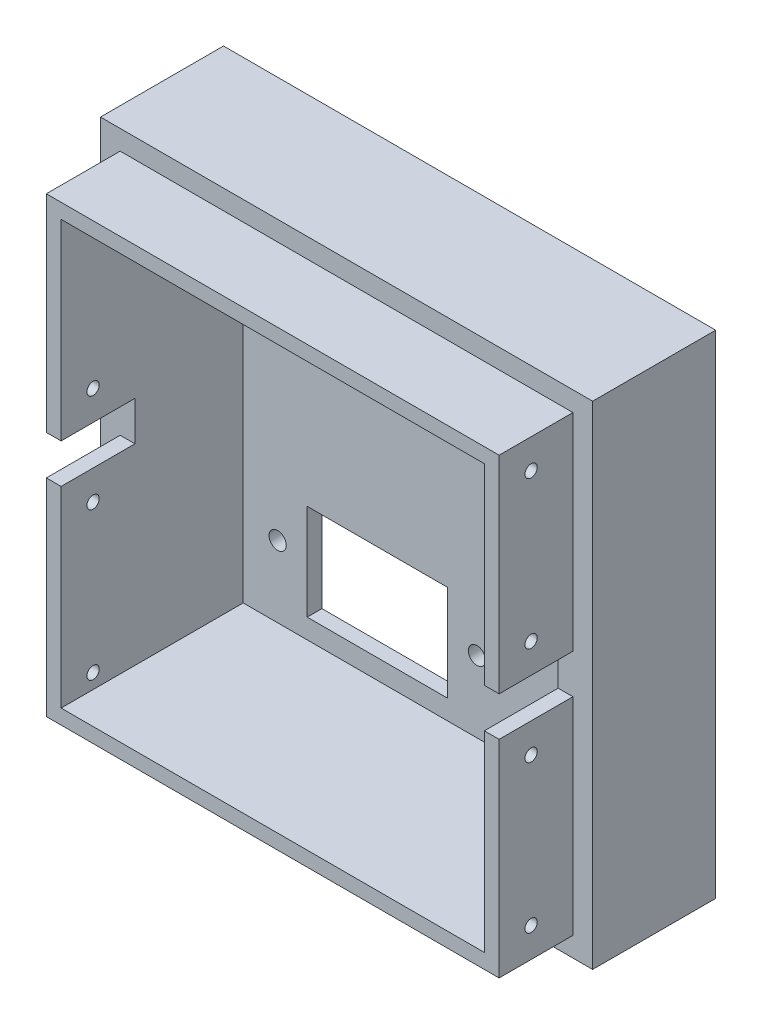
from build123d import *

# Parameters (mm, degrees)
SZKIC1_W                    = 100
SZKIC1_H                    = 100
DODANIE_WYCI_GNI_CIE1_DEPTH = 40
SZKIC3_W                    = 100
SZKIC3_H                    = 100
SZKIC3_W_2                  = 92
SZKIC3_H_2                  = 92
WYTNIJ_WYCI_GNI_CIE1_DEPTH  = 15
SZKIC4_W                    = 86
SZKIC4_H                    = 86
WYTNIJ_WYCI_GNI_CIE2_DEPTH  = 37
SZKIC6_W                    = 3
SZKIC6_H                    = 8
WYTNIJ_WYCI_GNI_CIE3_DEPTH  = 15
SZKIC9_R                    = 1.25
WYTNIJ_WYCI_GNI_CIE4_DEPTH  = 100
SZKIC10_R                   = 1.75
SZKIC10_W                   = 28.5
SZKIC10_H                   = 19.5
WYTNIJ_WYCI_GNI_CIE5_DEPTH  = 10
SZKIC11_W                   = 1.153846154
SZKIC11_H                   = 1
SZKIC11_H_2                 = 4.384615385
WYTNIJ_WYCI_GNI_CIE6_DEPTH  = 2
SZKIC12_R                   = 6.5
SZKIC12_R_2                 = 1.25
WYTNIJ_WYCI_GNI_CIE7_DEPTH  = 3
SZKIC13_R                   = 1
SZKIC13_W                   = 13
SZKIC13_H                   = 4
WYTNIJ_WYCI_GNI_CIE8_DEPTH  = 3


with BuildPart() as part:
    # Szkic1 → Dodanie-wyciągnięcie1 (new body)
    with BuildSketch(Plane.XY):
        with Locations((50, 50)):
            Rectangle(SZKIC1_W, SZKIC1_H)
    extrude(amount=DODANIE_WYCI_GNI_CIE1_DEPTH)

    # Szkic3 → Wytnij-wyciągnięcie1 (cut)
    with BuildSketch(Plane.XY.offset(40)):
        with Locations((50, 50)):
            Rectangle(SZKIC3_W, SZKIC3_H)
        with Locations((50, 50)):
            Rectangle(SZKIC3_W_2, SZKIC3_H_2, mode=Mode.SUBTRACT)
    extrude(amount=-WYTNIJ_WYCI_GNI_CIE1_DEPTH, mode=Mode.SUBTRACT)

    # Szkic4 → Wytnij-wyciągnięcie2 (cut)
    with BuildSketch(Plane.XY.offset(40)):
        with Locations((50, 50)):
            Rectangle(SZKIC4_W, SZKIC4_H)
    extrude(amount=-WYTNIJ_WYCI_GNI_CIE2_DEPTH, mode=Mode.SUBTRACT)

    # Szkic6 → Wytnij-wyciągnięcie3 (cut)
    with BuildSketch(Plane.XY.offset(40)):
        with Locations((5.5, 50)):
            Rectangle(SZKIC6_W, SZKIC6_H)
        with Locations((94.5, 50)):
            Rectangle(SZKIC6_W, SZKIC6_H)
    extrude(amount=-WYTNIJ_WYCI_GNI_CIE3_DEPTH, mode=Mode.SUBTRACT)

    # Szkic9 → Wytnij-wyciągnięcie4 (cut)
    with BuildSketch(Plane(origin=(96, 0, 0), x_dir=(0, 0, -1), z_dir=(1, 0, 0))):
        with Locations((-33.5, 60)):
            Circle(SZKIC9_R)
        with Locations((-33.5, 90)):
            Circle(SZKIC9_R)
        with Locations((-33.5, 40)):
            Circle(SZKIC9_R)
        with Locations((-33.5, 10)):
            Circle(SZKIC9_R)
    extrude(amount=-WYTNIJ_WYCI_GNI_CIE4_DEPTH, mode=Mode.SUBTRACT)

    # Szkic10 → Wytnij-wyciągnięcie5 (cut)
    with BuildSketch(Plane(origin=(0, 0, 0), x_dir=(-1, 0, 0), z_dir=(0, 0, -1))):
        with Locations((-54.5, 21.5)):
            Circle(SZKIC10_R)
        with Locations((-14, 21.5)):
            Circle(SZKIC10_R)
        with Locations((-34.25, 20.75)):
            Rectangle(SZKIC10_W, SZKIC10_H)
    extrude(amount=-WYTNIJ_WYCI_GNI_CIE5_DEPTH, mode=Mode.SUBTRACT)

    # Szkic11 → Wytnij-wyciągnięcie6 (cut)
    # profile 1 of 18: a face of its own
    with BuildSketch(Plane(origin=(0, 0, 0), x_dir=(-1, 0, 0), z_dir=(0, 0, -1))):
        with BuildLine():
            Line((-88.438026324, 50), (-88.438026324, 56))
            Line((-88.438026324, 56), (-87.28418017, 56))
            Line((-87.28418017, 56), (-87.28418017, 53.861778846))
            add(Edge.make_bspline(
                [(-87.28418017, 53.861778846), (-87.2409879, 53.90952015), (-87.156831408, 54.002540049), (-87.018245306, 54.124928355), (-86.874039765, 54.229121733), (-86.722831279, 54.313298956), (-86.566560567, 54.380903641), (-86.40372875, 54.427336018), (-86.234710156, 54.455976767), (-86.120031568, 54.45966595), (-86.061824401, 54.461538462)],
                knots=[0, 0, 0, 0, 1.09742733, 2.138244462, 3.14714167, 4.12618092, 5.084514129, 6.044794579, 7.007600552, 8, 8, 8, 8], degree=3))
            add(Edge.make_bspline(
                [(-86.061824401, 54.461538462), (-85.998803526, 54.460240324), (-85.875324724, 54.457696841), (-85.694662272, 54.42826264), (-85.52199364, 54.38450399), (-85.357069749, 54.321828525), (-85.201730271, 54.239060407), (-85.053867125, 54.140101748), (-84.915212722, 54.022433318), (-84.785340675, 53.888045244), (-84.667558215, 53.736249782), (-84.563487831, 53.568703554), (-84.477143379, 53.384449477), (-84.406226002, 53.185154165), (-84.351141212, 52.969894495), (-84.311815909, 52.739194657), (-84.289319503, 52.492834176), (-84.285926063, 52.323763914), (-84.28418017, 52.236778846)],
                knots=[0, 0, 0, 0, 0.942730505, 1.847121823, 2.733183872, 3.606606819, 4.481367714, 5.363155244, 6.265634696, 7.198966623, 8.156505419, 9.137011998, 10.145934455, 11.197093156, 12.299939524, 13.468576766, 14.697606431, 16, 16, 16, 16], degree=3))
            add(Edge.make_bspline(
                [(-84.28418017, 52.236778846), (-84.285938987, 52.146594052), (-84.289353055, 51.971534837), (-84.311585404, 51.716726356), (-84.351769525, 51.478329728), (-84.404522671, 51.255043238), (-84.475880448, 51.048305461), (-84.562704156, 50.857715492), (-84.663497668, 50.681540372), (-84.781370286, 50.523709881), (-84.91014754, 50.383593221), (-85.044749845, 50.25962985), (-85.187348199, 50.155312605), (-85.337366147, 50.071045712), (-85.493407278, 50.003760023), (-85.656585563, 49.957108224), (-85.826453283, 49.928667339), (-85.941921846, 49.924959026), (-86.000526324, 49.923076923)],
                knots=[0, 0, 0, 0, 1.342990017, 2.606900428, 3.804454117, 4.940338677, 6.01953414, 7.05541413, 8.055152764, 9.03596787, 9.981868581, 10.885627531, 11.756739119, 12.606254667, 13.442893865, 14.281233033, 15.127663507, 16, 16, 16, 16], degree=3))
            add(Edge.make_bspline(
                [(-86.000526324, 49.923076923), (-86.059157326, 49.92520152), (-86.176906424, 49.929468365), (-86.352728941, 49.963075267), (-86.526312714, 50.019599556), (-86.69821826, 50.094401621), (-86.863731589, 50.192757689), (-87.016761095, 50.317479719), (-87.160656485, 50.463218902), (-87.242330353, 50.575751554), (-87.28418017, 50.633413462)],
                knots=[0, 0, 0, 0, 0.921157575, 1.849967926, 2.801929881, 3.785969375, 4.79143669, 5.817208272, 6.881534093, 8, 8, 8, 8], degree=3))
            Line((-87.28418017, 50.633413462), (-87.28418017, 50))
            Line((-87.28418017, 50), (-88.438026324, 50))
        make_face()
        with BuildLine():
            add(Edge.make_bspline(
                [(-87.28418017, 52.275240385), (-87.283463921, 52.218732515), (-87.282081131, 52.109638521), (-87.272222401, 51.952066823), (-87.257535984, 51.805838811), (-87.233712448, 51.671359411), (-87.20806031, 51.546831993), (-87.170463699, 51.435152249), (-87.131523286, 51.332889695), (-87.096644036, 51.27206792), (-87.079853247, 51.242788462)],
                knots=[0, 0, 0, 0, 1.27404814, 2.459675089, 3.559050391, 4.585286877, 5.538680085, 6.421449734, 7.240089651, 8, 8, 8, 8], degree=3))
            add(Edge.make_bspline(
                [(-87.079853247, 51.242788462), (-87.055814981, 51.205352784), (-87.009166568, 51.13270549), (-86.927839549, 51.036152586), (-86.841498398, 50.953170968), (-86.747365928, 50.886829271), (-86.649224005, 50.832578715), (-86.543239023, 50.797042996), (-86.432718026, 50.772838865), (-86.356429067, 50.770442902), (-86.317834017, 50.769230769)],
                knots=[0, 0, 0, 0, 1.13317841, 2.199034441, 3.210601728, 4.17712673, 5.127651621, 6.057985678, 7.017523073, 8, 8, 8, 8], degree=3))
            add(Edge.make_bspline(
                [(-86.317834017, 50.769230769), (-86.287711505, 50.770008913), (-86.228640097, 50.771534884), (-86.141803738, 50.787999355), (-86.058225652, 50.81456616), (-85.977961073, 50.851872256), (-85.901164265, 50.899313428), (-85.82863209, 50.957952478), (-85.759316447, 51.026630034), (-85.692264047, 51.10482658), (-85.63238885, 51.195677182), (-85.578882427, 51.297978995), (-85.536710892, 51.414057406), (-85.498786183, 51.540553276), (-85.472268283, 51.680015093), (-85.451543003, 51.83080144), (-85.439729248, 51.993801662), (-85.438605498, 52.10655238), (-85.438026324, 52.164663462)],
                knots=[0, 0, 0, 0, 0.78356255, 1.536596371, 2.292155343, 3.062338243, 3.835342336, 4.636962799, 5.485351512, 6.373661662, 7.314050153, 8.312593822, 9.372473365, 10.524658142, 11.748175488, 13.064264604, 14.486938588, 16, 16, 16, 16], degree=3))
            add(Edge.make_bspline(
                [(-85.438026324, 52.164663462), (-85.438568556, 52.226783839), (-85.439612169, 52.346344478), (-85.451722407, 52.518896802), (-85.471818599, 52.678296261), (-85.500230485, 52.824102235), (-85.536203796, 52.956918729), (-85.580375246, 53.076240737), (-85.632710337, 53.1828029), (-85.694776737, 53.274971936), (-85.763028387, 53.354225156), (-85.833225999, 53.425133999), (-85.910320496, 53.483033391), (-85.990946017, 53.531752991), (-86.077029787, 53.569389212), (-86.16803908, 53.595326353), (-86.263037662, 53.613363011), (-86.328165089, 53.614705601), (-86.361103247, 53.615384615)],
                knots=[0, 0, 0, 0, 1.541669275, 2.967189997, 4.290690924, 5.527159073, 6.651403144, 7.702408128, 8.680806828, 9.590976681, 10.451726763, 11.274471125, 12.062089487, 12.838070645, 13.608488225, 14.385742736, 15.183590336, 16, 16, 16, 16], degree=3))
            add(Edge.make_bspline(
                [(-86.361103247, 53.615384615), (-86.393620258, 53.614591887), (-86.457447798, 53.613035844), (-86.55111235, 53.596824684), (-86.640123396, 53.570273453), (-86.725499548, 53.534019308), (-86.806068632, 53.486413817), (-86.883652654, 53.429981422), (-86.956004055, 53.361937475), (-87.023089039, 53.283663608), (-87.085207904, 53.195226372), (-87.13902924, 53.095701107), (-87.183414276, 52.984528071), (-87.220385831, 52.863525835), (-87.249252682, 52.731677242), (-87.268895594, 52.589000872), (-87.282942705, 52.435775288), (-87.283759895, 52.329762204), (-87.28418017, 52.275240385)],
                knots=[0, 0, 0, 0, 0.853654749, 1.675636261, 2.488263676, 3.289909134, 4.105938102, 4.941754496, 5.805666242, 6.708768126, 7.646124924, 8.639937881, 9.673965161, 10.786053658, 11.960883777, 13.21578984, 14.568099356, 16, 16, 16, 16], degree=3))
        make_face(mode=Mode.SUBTRACT)
    # profile 2 of 18: a face of its own
    with BuildSketch(Plane(origin=(0, 0, 0), x_dir=(-1, 0, 0), z_dir=(0, 0, -1))):
        with BuildLine():
            Line((-83.899564786, 54.384615385), (-82.745718632, 54.384615385))
            Line((-82.745718632, 54.384615385), (-81.78418017, 51.280048077))
            Line((-81.78418017, 51.280048077), (-80.822641709, 54.384615385))
            Line((-80.822641709, 54.384615385), (-79.668795555, 54.384615385))
            Line((-79.668795555, 54.384615385), (-81.126728247, 50.203125))
            Line((-81.126728247, 50.203125), (-81.403170555, 49.411057692))
            add(Edge.make_bspline(
                [(-81.403170555, 49.411057692), (-81.425903437, 49.354349662), (-81.468651851, 49.247712135), (-81.536784362, 49.099927646), (-81.601124989, 48.972451412), (-81.668144958, 48.865771071), (-81.733624363, 48.772478119), (-81.805390592, 48.692404446), (-81.880020044, 48.619009879), (-81.961102199, 48.555125652), (-82.04952495, 48.498464458), (-82.14700339, 48.450060934), (-82.253493204, 48.405890413), (-82.369651795, 48.37106823), (-82.493821137, 48.341061887), (-82.6263992, 48.323736786), (-82.766218678, 48.308769721), (-82.862258113, 48.308057899), (-82.911584017, 48.307692308)],
                knots=[0, 0, 0, 0, 1.442389574, 2.712364636, 3.842141792, 4.810870158, 5.685193676, 6.529785669, 7.346031511, 8.154233153, 8.962545531, 9.821428725, 10.720930479, 11.681493955, 12.682037037, 13.733651981, 14.836002494, 16, 16, 16, 16], degree=3))
            add(Edge.make_bspline(
                [(-82.911584017, 48.307692308), (-83.013234613, 48.310172035), (-83.216077822, 48.315120317), (-83.415475609, 48.352664515), (-83.514949401, 48.371394231)],
                knots=[0, 0, 0, 0, 1.002257816, 2, 2, 2, 2], degree=3))
            Line((-83.514949401, 48.371394231), (-83.591872478, 49.207932692))
            add(Edge.make_bspline(
                [(-83.591872478, 49.207932692), (-83.552286959, 49.199507974), (-83.475840713, 49.183238436), (-83.363099995, 49.166234895), (-83.256311712, 49.156415785), (-83.186842508, 49.154685048), (-83.153170555, 49.153846154)],
                knots=[0, 0, 0, 0, 1.096454798, 2.117437249, 3.087515614, 4, 4, 4, 4], degree=3))
            add(Edge.make_bspline(
                [(-83.153170555, 49.153846154), (-83.123890657, 49.154496079), (-83.067518926, 49.155747362), (-82.985636253, 49.166551516), (-82.909844348, 49.185705069), (-82.839970881, 49.212487424), (-82.774994455, 49.24458156), (-82.71672463, 49.286454874), (-82.664037631, 49.335215997), (-82.602075631, 49.412005257), (-82.53373991, 49.520605381), (-82.463359822, 49.665734529), (-82.401382173, 49.826494133), (-82.37009991, 49.940783525), (-82.353891709, 50)],
                knots=[0, 0, 0, 0, 0.826282398, 1.5908173, 2.325927711, 3.027474672, 3.700169566, 4.365407898, 5.04557163, 5.720354759, 7.144619778, 8.656909909, 10.267853154, 12, 12, 12, 12], degree=3))
            Line((-82.353891709, 50), (-83.899564786, 54.384615385))
        make_face()
    # profile 3 of 18: a face of its own
    with BuildSketch(Plane(origin=(0, 0, 0), x_dir=(-1, 0, 0), z_dir=(0, 0, -1))):
        with BuildLine():
            Line((-74.438026324, 56), (-73.28418017, 56))
            Line((-73.28418017, 56), (-73.28418017, 52.217548077))
            add(Edge.make_bspline(
                [(-73.28418017, 52.217548077), (-73.284695796, 52.157446276), (-73.28569637, 52.040818296), (-73.291844426, 51.87130117), (-73.300991696, 51.712528368), (-73.315063345, 51.564522679), (-73.334891098, 51.427604055), (-73.355904378, 51.300680335), (-73.381417038, 51.184393011), (-73.404279125, 51.111642431), (-73.415189786, 51.076923077)],
                knots=[0, 0, 0, 0, 1.251619961, 2.428777588, 3.532126049, 4.56323557, 5.523704531, 6.412540087, 7.242403515, 8, 8, 8, 8], degree=3))
            add(Edge.make_bspline(
                [(-73.415189786, 51.076923077), (-73.430437557, 51.034139374), (-73.460613775, 50.949467955), (-73.519266699, 50.828687794), (-73.586714532, 50.714341946), (-73.662767453, 50.60593488), (-73.746707103, 50.503031954), (-73.841380564, 50.408345447), (-73.943457479, 50.31857262), (-74.055809156, 50.237433406), (-74.175607991, 50.161780163), (-74.306266603, 50.098748917), (-74.44521423, 50.044226053), (-74.593617022, 49.999940414), (-74.751518012, 49.965289582), (-74.918512677, 49.940068314), (-75.09482348, 49.925737068), (-75.215243932, 49.923978383), (-75.276968632, 49.923076923)],
                knots=[0, 0, 0, 0, 0.925533072, 1.831683394, 2.73255258, 3.630007683, 4.529542467, 5.436465751, 6.357118906, 7.298274949, 8.259461937, 9.242242071, 10.251058183, 11.300341426, 12.396409345, 13.544807631, 14.74152597, 16, 16, 16, 16], degree=3))
            add(Edge.make_bspline(
                [(-75.276968632, 49.923076923), (-75.349140887, 49.92482129), (-75.489450262, 49.928212496), (-75.693486966, 49.950727007), (-75.884828332, 49.990105836), (-76.062898606, 50.046984986), (-76.229517368, 50.117691228), (-76.382669337, 50.205887561), (-76.523168463, 50.309804524), (-76.650101111, 50.429760619), (-76.763530029, 50.564542795), (-76.861439466, 50.715333595), (-76.944538499, 50.880556087), (-77.01150214, 51.060957731), (-77.064370083, 51.255674843), (-77.102502986, 51.465117405), (-77.125257337, 51.689404674), (-77.128609421, 51.843696273), (-77.130334017, 51.923076923)],
                knots=[0, 0, 0, 0, 1.114068574, 2.165849827, 3.164101702, 4.124467949, 5.046988974, 5.952942428, 6.846011651, 7.738523925, 8.642829306, 9.558838605, 10.50752403, 11.491963144, 12.524197802, 13.618364352, 14.774685164, 16, 16, 16, 16], degree=3))
            Line((-77.130334017, 51.923076923), (-75.976487863, 52))
            add(Edge.make_bspline(
                [(-75.976487863, 52), (-75.974415528, 51.95750937), (-75.970441708, 51.876031203), (-75.959407776, 51.758576772), (-75.945455148, 51.650622388), (-75.927198423, 51.552492068), (-75.907537944, 51.463356639), (-75.881998675, 51.384970258), (-75.855149345, 51.314576625), (-75.831566597, 51.273390739), (-75.820237863, 51.253605769)],
                knots=[0, 0, 0, 0, 1.326609226, 2.543847584, 3.678365909, 4.719972403, 5.656527627, 6.521948534, 7.28997025, 8, 8, 8, 8], degree=3))
            add(Edge.make_bspline(
                [(-75.820237863, 51.253605769), (-75.802894723, 51.227437655), (-75.768761264, 51.175935546), (-75.706492784, 51.10882288), (-75.639641373, 51.050149237), (-75.564549847, 51.004019986), (-75.483308387, 50.967740717), (-75.395307123, 50.941378847), (-75.300788682, 50.925394252), (-75.235766484, 50.923862028), (-75.202449401, 50.923076923)],
                knots=[0, 0, 0, 0, 1.023658308, 2.014687051, 2.979722519, 3.920049697, 4.880550909, 5.878122304, 6.912759386, 8, 8, 8, 8], degree=3))
            add(Edge.make_bspline(
                [(-75.202449401, 50.923076923), (-75.168763307, 50.923704652), (-75.104007887, 50.924911348), (-75.010687813, 50.935884301), (-74.924884628, 50.953664709), (-74.846551598, 50.978657757), (-74.775423377, 51.011102407), (-74.713076589, 51.052609721), (-74.656824644, 51.099314845), (-74.608231843, 51.155497869), (-74.566829825, 51.223193909), (-74.532261021, 51.305588915), (-74.502522418, 51.403021805), (-74.479538912, 51.516233297), (-74.459975415, 51.644139571), (-74.44770364, 51.787871546), (-74.438882599, 51.947004415), (-74.438319727, 52.058479098), (-74.438026324, 52.116586538)],
                knots=[0, 0, 0, 0, 0.980314827, 1.884477813, 2.730827652, 3.527503874, 4.27366112, 4.998269146, 5.70163477, 6.396145331, 7.150281155, 8.001758491, 8.990432449, 10.111292654, 11.361572691, 12.75538406, 14.308707205, 16, 16, 16, 16], degree=3))
            Line((-74.438026324, 52.116586538), (-74.438026324, 56))
        make_face()
    # profile 4 of 18: a face of its own
    with BuildSketch(Plane(origin=(0, 0, 0), x_dir=(-1, 0, 0), z_dir=(0, 0, -1))):
        with BuildLine():
            Line((-71.28418017, 53.076923077), (-72.28418017, 53.230769231))
            add(Edge.make_bspline(
                [(-72.28418017, 53.230769231), (-72.269193729, 53.281454323), (-72.239858076, 53.380669359), (-72.186026678, 53.522845402), (-72.122990658, 53.654287032), (-72.053470867, 53.776564533), (-71.975325166, 53.888341174), (-71.88980256, 53.989907729), (-71.796419711, 54.080916588), (-71.694730321, 54.162072318), (-71.582777994, 54.234166119), (-71.458021391, 54.295287315), (-71.320647487, 54.34675223), (-71.170849163, 54.38811199), (-71.008877739, 54.42269035), (-70.83349346, 54.443858699), (-70.645827526, 54.45913896), (-70.516586871, 54.460722932), (-70.450045555, 54.461538462)],
                knots=[0, 0, 0, 0, 1.047140172, 2.049755565, 3.008539736, 3.933190086, 4.833981818, 5.707167246, 6.560530269, 7.413560864, 8.281243119, 9.193714071, 10.161006392, 11.183910126, 12.270717139, 13.439589873, 14.681737877, 16, 16, 16, 16], degree=3))
            add(Edge.make_bspline(
                [(-70.450045555, 54.461538462), (-70.389537866, 54.461202519), (-70.272464995, 54.460552523), (-70.102860985, 54.452030803), (-69.945202932, 54.438057545), (-69.799697112, 54.417402598), (-69.665863964, 54.392840427), (-69.544130909, 54.361692912), (-69.434135531, 54.324935372), (-69.307043025, 54.267796502), (-69.167439373, 54.187501868), (-69.0217328, 54.078475711), (-68.904832279, 53.954453054), (-68.827466393, 53.838700642), (-68.7817772, 53.733784032), (-68.749537344, 53.641346323), (-68.72637279, 53.533342307), (-68.703573397, 53.411318352), (-68.689582125, 53.274614219), (-68.676955392, 53.123196354), (-68.670116911, 52.957192479), (-68.669246923, 52.841350993), (-68.668795555, 52.78125)],
                knots=[0, 0, 0, 0, 1.253259065, 2.424859341, 3.516580225, 4.530621704, 5.468151732, 6.333678254, 7.13150538, 7.867126506, 9.216626747, 10.459871386, 11.622324159, 12.731817101, 13.322505456, 13.989117254, 14.756090433, 15.607496751, 16.559714447, 17.600403876, 18.755039204, 20, 20, 20, 20], degree=3))
            Line((-68.668795555, 52.78125), (-68.668795555, 51.433894231))
            add(Edge.make_bspline(
                [(-68.668795555, 51.433894231), (-68.668421798, 51.387421334), (-68.667700014, 51.297674757), (-68.66622042, 51.167793114), (-68.659520723, 51.047629266), (-68.6524818, 50.937035148), (-68.644372344, 50.835579266), (-68.63384868, 50.743729956), (-68.62067995, 50.661089558), (-68.599552528, 50.562391997), (-68.565567888, 50.442645159), (-68.510002506, 50.299109879), (-68.443347315, 50.149604989), (-68.389089641, 50.050908281), (-68.361103247, 50)],
                knots=[0, 0, 0, 0, 1.124218554, 2.171045354, 3.141373911, 4.034856482, 4.851737235, 5.603038048, 6.270604849, 6.87504238, 8.043824301, 9.276776929, 10.59534724, 12, 12, 12, 12], degree=3))
            Line((-68.361103247, 50), (-69.514949401, 50))
            add(Edge.make_bspline(
                [(-69.514949401, 50), (-69.52318507, 50.023165167), (-69.541231108, 50.073924795), (-69.565602347, 50.159011482), (-69.594809685, 50.258147789), (-69.614066321, 50.32968195), (-69.624324401, 50.367788462)],
                knots=[0, 0, 0, 0, 0.768508203, 1.683958961, 2.766236402, 4, 4, 4, 4], degree=3))
            add(Edge.make_bspline(
                [(-69.624324401, 50.367788462), (-69.628746882, 50.384611338), (-69.636751936, 50.41506213), (-69.647419435, 50.456478366), (-69.656667552, 50.488142365), (-69.662743803, 50.506023242), (-69.665189786, 50.513221154)],
                knots=[0, 0, 0, 0, 1.381357368, 2.500370598, 3.396327181, 4, 4, 4, 4], degree=3))
            add(Edge.make_bspline(
                [(-69.665189786, 50.513221154), (-69.714002495, 50.466160381), (-69.809520764, 50.374070357), (-69.965303278, 50.254804507), (-70.124458334, 50.152131613), (-70.289571431, 50.068338782), (-70.459400909, 50.002850664), (-70.635628082, 49.957183735), (-70.817310889, 49.928768438), (-70.940727815, 49.924984191), (-71.00293017, 49.923076923)],
                knots=[0, 0, 0, 0, 1.082260538, 2.117802027, 3.127898709, 4.103827344, 5.070056335, 6.029309159, 7.006768236, 8, 8, 8, 8], degree=3))
            add(Edge.make_bspline(
                [(-71.00293017, 49.923076923), (-71.057050405, 49.924329626), (-71.162755289, 49.926776342), (-71.317001507, 49.942938831), (-71.461990886, 49.973592652), (-71.598387506, 50.014360927), (-71.726522126, 50.065614595), (-71.845287644, 50.13001036), (-71.955380799, 50.206104417), (-72.055708835, 50.293618163), (-72.145628995, 50.389668956), (-72.224544063, 50.491866514), (-72.28982661, 50.601581346), (-72.343834562, 50.716698465), (-72.386565741, 50.838225691), (-72.416041376, 50.96561017), (-72.434830102, 51.099201521), (-72.436945118, 51.190239709), (-72.438026324, 51.236778846)],
                knots=[0, 0, 0, 0, 1.186431605, 2.317277787, 3.39378889, 4.430144672, 5.434756152, 6.413230964, 7.385260177, 8.362630794, 9.325691837, 10.265445477, 11.187216893, 12.118354241, 13.048828682, 14.005299944, 14.980300216, 16, 16, 16, 16], degree=3))
            add(Edge.make_bspline(
                [(-72.438026324, 51.236778846), (-72.436062586, 51.297834012), (-72.432209353, 51.417635992), (-72.398544919, 51.591684686), (-72.345828058, 51.756090082), (-72.270901119, 51.908789877), (-72.177669497, 52.048417015), (-72.065510889, 52.171662406), (-71.936041743, 52.276601468), (-71.786434816, 52.365718653), (-71.610970343, 52.440789132), (-71.406051378, 52.513108171), (-71.166688651, 52.577923045), (-70.995103708, 52.615006355), (-70.904372478, 52.634615385)],
                knots=[0, 0, 0, 0, 0.9565892, 1.877012003, 2.769038917, 3.656897043, 4.535078379, 5.39337207, 6.259743944, 7.138913465, 8.11486349, 9.247429708, 10.544487161, 12, 12, 12, 12], degree=3))
            add(Edge.make_bspline(
                [(-70.904372478, 52.634615385), (-70.841852239, 52.647337324), (-70.721502976, 52.67182661), (-70.548627014, 52.708647181), (-70.39069125, 52.745759478), (-70.248365917, 52.783461035), (-70.120145927, 52.81771537), (-70.007369493, 52.852232864), (-69.909591597, 52.886972979), (-69.850197809, 52.911634885), (-69.822641709, 52.923076923)],
                knots=[0, 0, 0, 0, 1.365613701, 2.628758346, 3.783158308, 4.837685682, 5.780080249, 6.623655076, 7.36143661, 8, 8, 8, 8], degree=3))
            Line((-69.822641709, 52.923076923), (-69.822641709, 53.032451923))
            add(Edge.make_bspline(
                [(-69.822641709, 53.032451923), (-69.824179247, 53.081486252), (-69.827034541, 53.172545788), (-69.855420909, 53.298812886), (-69.904696594, 53.402813866), (-69.964175356, 53.472129873), (-70.023023725, 53.513944517), (-70.074986327, 53.541773589), (-70.135876952, 53.563983198), (-70.20484029, 53.583668063), (-70.283061581, 53.597119499), (-70.369637858, 53.60828901), (-70.464801208, 53.613769649), (-70.530970485, 53.614831581), (-70.56543017, 53.615384615)],
                knots=[0, 0, 0, 0, 1.600506204, 2.972230995, 4.195852174, 5.327580964, 5.908906329, 6.547275261, 7.247479517, 8.022494018, 8.887774365, 9.837646189, 10.873887764, 12, 12, 12, 12], degree=3))
            add(Edge.make_bspline(
                [(-70.56543017, 53.615384615), (-70.611220403, 53.614290459), (-70.69823371, 53.612211278), (-70.820856159, 53.588947913), (-70.92875354, 53.55248153), (-71.022277809, 53.498038034), (-71.102902805, 53.42407715), (-71.173107644, 53.328702436), (-71.235301399, 53.211498615), (-71.26727431, 53.123469159), (-71.28418017, 53.076923077)],
                knots=[0, 0, 0, 0, 1.120680009, 2.129582446, 3.045508635, 3.899130849, 4.760899303, 5.707254252, 6.787697471, 8, 8, 8, 8], degree=3))
        make_face()
        with BuildLine():
            add(Edge.make_bspline(
                [(-69.822641709, 52.076923077), (-69.862243056, 52.064693816), (-69.951435839, 52.037150261), (-70.10125381, 51.996682767), (-70.281837701, 51.954039218), (-70.448366237, 51.917140375), (-70.587381884, 51.887171292), (-70.685447904, 51.862667907), (-70.773817366, 51.839303218), (-70.852622412, 51.814766652), (-70.921968513, 51.791669677), (-70.980846098, 51.766920718), (-71.031304504, 51.745249404), (-71.059605956, 51.727106629), (-71.072641709, 51.71875)],
                knots=[0, 0, 0, 0, 1.144223484, 2.577096135, 4.283377528, 6.266557578, 7.286341447, 8.209198618, 9.057088726, 9.80932547, 10.487940513, 11.073343897, 11.57317876, 12, 12, 12, 12], degree=3))
            add(Edge.make_bspline(
                [(-71.072641709, 51.71875), (-71.104913236, 51.693332788), (-71.166846281, 51.644554021), (-71.234360476, 51.550290098), (-71.277202477, 51.445784564), (-71.281825791, 51.371806992), (-71.28418017, 51.334134615)],
                knots=[0, 0, 0, 0, 1.075028234, 2.063111864, 3.013658082, 4, 4, 4, 4], degree=3))
            add(Edge.make_bspline(
                [(-71.28418017, 51.334134615), (-71.2821036, 51.296651405), (-71.278030249, 51.223125253), (-71.245585883, 51.117176964), (-71.191027434, 51.020112024), (-71.116719549, 50.933822099), (-71.027304678, 50.859117489), (-70.921905103, 50.807914419), (-70.805786902, 50.774851971), (-70.724324669, 50.771152246), (-70.682016709, 50.769230769)],
                knots=[0, 0, 0, 0, 0.976809721, 1.916086158, 2.861451878, 3.862738809, 4.873423621, 5.878632484, 6.898253484, 8, 8, 8, 8], degree=3))
            add(Edge.make_bspline(
                [(-70.682016709, 50.769230769), (-70.633672579, 50.771418262), (-70.536346713, 50.775822097), (-70.393605511, 50.816059902), (-70.252675587, 50.875450326), (-70.167103844, 50.933900587), (-70.123122478, 50.963942308)],
                knots=[0, 0, 0, 0, 0.962503947, 1.937702252, 2.940039444, 4, 4, 4, 4], degree=3))
            add(Edge.make_bspline(
                [(-70.123122478, 50.963942308), (-70.092061214, 50.988948602), (-70.031667578, 51.037569322), (-69.959686849, 51.126419026), (-69.900286791, 51.220933923), (-69.876613427, 51.290659089), (-69.864709017, 51.325721154)],
                knots=[0, 0, 0, 0, 1.055399509, 2.052054707, 3.020454315, 4, 4, 4, 4], degree=3))
            add(Edge.make_bspline(
                [(-69.864709017, 51.325721154), (-69.85814805, 51.354474418), (-69.842789686, 51.421782038), (-69.83195399, 51.540274087), (-69.823188591, 51.689359924), (-69.822835096, 51.799254585), (-69.822641709, 51.859375)],
                knots=[0, 0, 0, 0, 0.659054705, 1.542760655, 2.655710416, 4, 4, 4, 4], degree=3))
            Line((-69.822641709, 51.859375), (-69.822641709, 52.076923077))
        make_face(mode=Mode.SUBTRACT)
    # profile 5 of 18: a face of its own
    with BuildSketch(Plane(origin=(0, 0, 0), x_dir=(-1, 0, 0), z_dir=(0, 0, -1))):
        Polygon((-67.438026324, 50), (-67.438026324, 56), (-66.28418017, 56), (-66.28418017, 52.840144231), (-64.938026324, 54.384615385), (-63.630334017, 54.384615385), (-65.078651324, 52.758413462), (-63.55341094, 50), (-64.707257094, 50), (-65.808218632, 51.938701923), (-66.28418017, 51.403846154), (-66.28418017, 50), align=None)
    # profile 6 of 18: a face of its own
    with BuildSketch(Plane(origin=(0, 0, 0), x_dir=(-1, 0, 0), z_dir=(0, 0, -1))):
        with BuildLine():
            Line((-60.130334017, 50), (-60.130334017, 50.645432692))
            add(Edge.make_bspline(
                [(-60.130334017, 50.645432692), (-60.168536487, 50.590190016), (-60.244344493, 50.48056786), (-60.383657598, 50.336917585), (-60.539664823, 50.212271372), (-60.71127887, 50.108388796), (-60.893230245, 50.025533876), (-61.082472009, 49.966044309), (-61.276818716, 49.930307915), (-61.408233578, 49.925490749), (-61.474084017, 49.923076923)],
                knots=[0, 0, 0, 0, 1.012300957, 2.008784164, 3.006972158, 4.019128624, 5.028517728, 6.017265291, 7.006475003, 8, 8, 8, 8], degree=3))
            add(Edge.make_bspline(
                [(-61.474084017, 49.923076923), (-61.540758472, 49.925284029), (-61.671517242, 49.929612499), (-61.862040167, 49.966719549), (-62.041885549, 50.027368915), (-62.210158624, 50.110765635), (-62.361234701, 50.217507425), (-62.492757439, 50.343892165), (-62.599044219, 50.491885185), (-62.669641, 50.629492287), (-62.713942648, 50.750476127), (-62.742265979, 50.850698609), (-62.767942827, 50.959247417), (-62.787644463, 51.076129808), (-62.803627744, 51.201214447), (-62.813670159, 51.334415225), (-62.82146876, 51.47627154), (-62.822243438, 51.573705853), (-62.822641709, 51.623798077)],
                knots=[0, 0, 0, 0, 1.289498181, 2.528902495, 3.740215999, 4.953909685, 6.150063847, 7.307074614, 8.467199117, 9.660131987, 10.288158488, 10.958106275, 11.674712228, 12.445953132, 13.25095176, 14.114470792, 15.030625377, 16, 16, 16, 16], degree=3))
            Line((-62.822641709, 51.623798077), (-62.822641709, 54.384615385))
            Line((-62.822641709, 54.384615385), (-61.668795555, 54.384615385))
            Line((-61.668795555, 54.384615385), (-61.668795555, 52.361778846))
            add(Edge.make_bspline(
                [(-61.668795555, 52.361778846), (-61.668457236, 52.288061119), (-61.667815515, 52.148233942), (-61.665947317, 51.949488382), (-61.660821011, 51.773610981), (-61.65534481, 51.620104811), (-61.647224825, 51.489022298), (-61.636696137, 51.380368553), (-61.624943091, 51.294132428), (-61.608873986, 51.210063007), (-61.575881094, 51.1256862), (-61.530436112, 51.035049768), (-61.468311175, 50.957248383), (-61.396444511, 50.889675977), (-61.312698269, 50.833683035), (-61.216096708, 50.798326679), (-61.110900313, 50.771935691), (-61.036772184, 50.770157764), (-60.998122478, 50.769230769)],
                knots=[0, 0, 0, 0, 1.799930418, 3.414093185, 4.852592097, 6.095879458, 7.164323302, 8.058836106, 8.760219181, 9.289718358, 10.143846288, 10.96209893, 11.756558504, 12.559405005, 13.365225682, 14.195378484, 15.059087384, 16, 16, 16, 16], degree=3))
            add(Edge.make_bspline(
                [(-60.998122478, 50.769230769), (-60.953496048, 50.771454805), (-60.865617315, 50.775834395), (-60.737181724, 50.806355134), (-60.617234376, 50.859360042), (-60.505387737, 50.929867152), (-60.407465953, 51.017162275), (-60.322434698, 51.114121568), (-60.256198336, 51.221870329), (-60.213963288, 51.322292091), (-60.188653894, 51.41740311), (-60.174767264, 51.511803301), (-60.159531039, 51.627067355), (-60.150214648, 51.764770968), (-60.139738394, 51.924150878), (-60.134680089, 52.105744967), (-60.13087349, 52.309277037), (-60.130520102, 52.452320915), (-60.130334017, 52.527644231)],
                knots=[0, 0, 0, 0, 0.960139447, 1.890714513, 2.821289579, 3.770841791, 4.723832156, 5.63466777, 6.536687779, 7.433335375, 7.968708987, 8.650470788, 9.484586637, 10.470508532, 11.619255361, 12.921832212, 14.379114108, 16, 16, 16, 16], degree=3))
            Line((-60.130334017, 52.527644231), (-60.130334017, 54.384615385))
            Line((-60.130334017, 54.384615385), (-58.976487863, 54.384615385))
            Line((-58.976487863, 54.384615385), (-58.976487863, 50))
            Line((-58.976487863, 50), (-60.130334017, 50))
        make_face()
    # profile 7 of 18: a face of its own
    with BuildSketch(Plane(origin=(0, 0, 0), x_dir=(-1, 0, 0), z_dir=(0, 0, -1))):
        with BuildLine():
            Line((-57.745718632, 50), (-57.745718632, 56))
            Line((-57.745718632, 56), (-56.591872478, 56))
            Line((-56.591872478, 56), (-56.591872478, 53.861778846))
            add(Edge.make_bspline(
                [(-56.591872478, 53.861778846), (-56.548680207, 53.90952015), (-56.464523716, 54.002540049), (-56.325937613, 54.124928355), (-56.181732073, 54.229121733), (-56.030523586, 54.313298956), (-55.874252874, 54.380903641), (-55.711421058, 54.427336018), (-55.542402464, 54.455976767), (-55.427723875, 54.45966595), (-55.369516709, 54.461538462)],
                knots=[0, 0, 0, 0, 1.09742733, 2.138244462, 3.14714167, 4.12618092, 5.084514129, 6.044794579, 7.007600552, 8, 8, 8, 8], degree=3))
            add(Edge.make_bspline(
                [(-55.369516709, 54.461538462), (-55.306495834, 54.460240324), (-55.183017032, 54.457696841), (-55.00235458, 54.42826264), (-54.829685948, 54.38450399), (-54.664762056, 54.321828525), (-54.509422579, 54.239060407), (-54.361559433, 54.140101748), (-54.22290503, 54.022433318), (-54.093032982, 53.888045244), (-53.975250522, 53.736249782), (-53.871180139, 53.568703554), (-53.784835687, 53.384449477), (-53.713918309, 53.185154165), (-53.65883352, 52.969894495), (-53.619508216, 52.739194657), (-53.597011811, 52.492834176), (-53.593618371, 52.323763914), (-53.591872478, 52.236778846)],
                knots=[0, 0, 0, 0, 0.942730505, 1.847121823, 2.733183872, 3.606606819, 4.481367714, 5.363155244, 6.265634696, 7.198966623, 8.156505419, 9.137011998, 10.145934455, 11.197093156, 12.299939524, 13.468576766, 14.697606431, 16, 16, 16, 16], degree=3))
            add(Edge.make_bspline(
                [(-53.591872478, 52.236778846), (-53.593631295, 52.146594052), (-53.597045363, 51.971534837), (-53.619277712, 51.716726356), (-53.659461833, 51.478329728), (-53.712214979, 51.255043238), (-53.783572756, 51.048305461), (-53.870396464, 50.857715492), (-53.971189976, 50.681540372), (-54.089062594, 50.523709881), (-54.217839848, 50.383593221), (-54.352442153, 50.25962985), (-54.495040507, 50.155312605), (-54.645058455, 50.071045712), (-54.801099586, 50.003760023), (-54.96427787, 49.957108224), (-55.134145591, 49.928667339), (-55.249614154, 49.924959026), (-55.308218632, 49.923076923)],
                knots=[0, 0, 0, 0, 1.342990017, 2.606900428, 3.804454117, 4.940338677, 6.01953414, 7.05541413, 8.055152764, 9.03596787, 9.981868581, 10.885627531, 11.756739119, 12.606254667, 13.442893865, 14.281233033, 15.127663507, 16, 16, 16, 16], degree=3))
            add(Edge.make_bspline(
                [(-55.308218632, 49.923076923), (-55.366849634, 49.92520152), (-55.484598732, 49.929468365), (-55.660421249, 49.963075267), (-55.834005022, 50.019599556), (-56.005910567, 50.094401621), (-56.171423897, 50.192757689), (-56.324453403, 50.317479719), (-56.468348793, 50.463218902), (-56.55002266, 50.575751554), (-56.591872478, 50.633413462)],
                knots=[0, 0, 0, 0, 0.921157575, 1.849967926, 2.801929881, 3.785969375, 4.79143669, 5.817208272, 6.881534093, 8, 8, 8, 8], degree=3))
            Line((-56.591872478, 50.633413462), (-56.591872478, 50))
            Line((-56.591872478, 50), (-57.745718632, 50))
        make_face()
        with BuildLine():
            add(Edge.make_bspline(
                [(-56.591872478, 52.275240385), (-56.591156229, 52.218732515), (-56.589773438, 52.109638521), (-56.579914709, 51.952066823), (-56.565228292, 51.805838811), (-56.541404756, 51.671359411), (-56.515752618, 51.546831993), (-56.478156006, 51.435152249), (-56.439215594, 51.332889695), (-56.404336343, 51.27206792), (-56.387545555, 51.242788462)],
                knots=[0, 0, 0, 0, 1.27404814, 2.459675089, 3.559050391, 4.585286877, 5.538680085, 6.421449734, 7.240089651, 8, 8, 8, 8], degree=3))
            add(Edge.make_bspline(
                [(-56.387545555, 51.242788462), (-56.363507289, 51.205352784), (-56.316858876, 51.13270549), (-56.235531857, 51.036152586), (-56.149190705, 50.953170968), (-56.055058236, 50.886829271), (-55.956916313, 50.832578715), (-55.850931331, 50.797042996), (-55.740410334, 50.772838865), (-55.664121375, 50.770442902), (-55.625526324, 50.769230769)],
                knots=[0, 0, 0, 0, 1.13317841, 2.199034441, 3.210601728, 4.17712673, 5.127651621, 6.057985678, 7.017523073, 8, 8, 8, 8], degree=3))
            add(Edge.make_bspline(
                [(-55.625526324, 50.769230769), (-55.595403812, 50.770008913), (-55.536332405, 50.771534884), (-55.449496046, 50.787999355), (-55.36591796, 50.81456616), (-55.28565338, 50.851872256), (-55.208856573, 50.899313428), (-55.136324398, 50.957952478), (-55.067008754, 51.026630034), (-54.999956355, 51.10482658), (-54.940081158, 51.195677182), (-54.886574735, 51.297978995), (-54.8444032, 51.414057406), (-54.806478491, 51.540553276), (-54.779960591, 51.680015093), (-54.759235311, 51.83080144), (-54.747421555, 51.993801662), (-54.746297806, 52.10655238), (-54.745718632, 52.164663462)],
                knots=[0, 0, 0, 0, 0.78356255, 1.536596371, 2.292155343, 3.062338243, 3.835342336, 4.636962799, 5.485351512, 6.373661662, 7.314050153, 8.312593822, 9.372473365, 10.524658142, 11.748175488, 13.064264604, 14.486938588, 16, 16, 16, 16], degree=3))
            add(Edge.make_bspline(
                [(-54.745718632, 52.164663462), (-54.746260864, 52.226783839), (-54.747304476, 52.346344478), (-54.759414714, 52.518896802), (-54.779510907, 52.678296261), (-54.807922793, 52.824102235), (-54.843896104, 52.956918729), (-54.888067554, 53.076240737), (-54.940402645, 53.1828029), (-55.002469045, 53.274971936), (-55.070720694, 53.354225156), (-55.140918307, 53.425133999), (-55.218012804, 53.483033391), (-55.298638325, 53.531752991), (-55.384722094, 53.569389212), (-55.475731388, 53.595326353), (-55.57072997, 53.613363011), (-55.635857397, 53.614705601), (-55.668795555, 53.615384615)],
                knots=[0, 0, 0, 0, 1.541669275, 2.967189997, 4.290690924, 5.527159073, 6.651403144, 7.702408128, 8.680806828, 9.590976681, 10.451726763, 11.274471125, 12.062089487, 12.838070645, 13.608488225, 14.385742736, 15.183590336, 16, 16, 16, 16], degree=3))
            add(Edge.make_bspline(
                [(-55.668795555, 53.615384615), (-55.701312566, 53.614591887), (-55.765140106, 53.613035844), (-55.858804658, 53.596824684), (-55.947815704, 53.570273453), (-56.033191856, 53.534019308), (-56.113760939, 53.486413817), (-56.191344962, 53.429981422), (-56.263696363, 53.361937475), (-56.330781347, 53.283663608), (-56.392900211, 53.195226372), (-56.446721547, 53.095701107), (-56.491106584, 52.984528071), (-56.528078139, 52.863525835), (-56.556944989, 52.731677242), (-56.576587901, 52.589000872), (-56.590635012, 52.435775288), (-56.591452203, 52.329762204), (-56.591872478, 52.275240385)],
                knots=[0, 0, 0, 0, 0.853654749, 1.675636261, 2.488263676, 3.289909134, 4.105938102, 4.941754496, 5.805666242, 6.708768126, 7.646124924, 8.639937881, 9.673965161, 10.786053658, 11.960883777, 13.21578984, 14.568099356, 16, 16, 16, 16], degree=3))
        make_face(mode=Mode.SUBTRACT)
    # profile 8 of 18: a face of its own
    with BuildSketch(Plane(origin=(0, 0, 0), x_dir=(-1, 0, 0), z_dir=(0, 0, -1))):
        Polygon((-50.361103247, 50), (-50.361103247, 56), (-49.207257094, 56), (-49.207257094, 53.313701923), (-46.677209017, 56), (-45.091872478, 56), (-47.370718632, 53.680288462), (-45.014949401, 50), (-46.552209017, 50), (-48.245718632, 52.787259615), (-49.207257094, 51.808894231), (-49.207257094, 50), align=None)
    # profile 9 of 18: a face of its own
    with BuildSketch(Plane(origin=(0, 0, 0), x_dir=(-1, 0, 0), z_dir=(0, 0, -1))):
        with BuildLine():
            add(Edge.make_bspline(
                [(-44.668795555, 52.253605769), (-44.665093639, 52.348369226), (-44.657682632, 52.538079825), (-44.604746763, 52.819884992), (-44.51514451, 53.096033183), (-44.414848631, 53.320088826), (-44.31581632, 53.491377839), (-44.235841414, 53.614895244), (-44.146558155, 53.729133332), (-44.049793929, 53.834816046), (-43.947725417, 53.934476942), (-43.836758646, 54.024449748), (-43.718328806, 54.106284839), (-43.59359227, 54.180884997), (-43.46272736, 54.246385966), (-43.328163605, 54.304609677), (-43.189357221, 54.352449933), (-43.047275322, 54.392122915), (-42.901301808, 54.423942054), (-42.751396418, 54.444774526), (-42.597740693, 54.458665531), (-42.494147196, 54.460572005), (-42.441632094, 54.461538462)],
                knots=[0, 0, 0, 0, 1.619840069, 3.242819969, 4.882696853, 6.574901176, 7.427927767, 8.263869039, 9.088735507, 9.903385011, 10.712399333, 11.525463381, 12.34252837, 13.171904741, 14.008210778, 14.842888174, 15.67691885, 16.516221154, 17.363978437, 18.229048737, 19.10224397, 20, 20, 20, 20], degree=3))
            add(Edge.make_bspline(
                [(-42.441632094, 54.461538462), (-42.361809911, 54.459831324), (-42.204783349, 54.456473034), (-41.974905321, 54.425882971), (-41.756366961, 54.375486511), (-41.548873351, 54.305314047), (-41.352268096, 54.215358426), (-41.167540142, 54.10354499), (-40.993163288, 53.97315428), (-40.832437952, 53.823390984), (-40.68552758, 53.659409173), (-40.558113463, 53.482129377), (-40.449363849, 53.294980924), (-40.35929514, 53.097666293), (-40.290927425, 52.889144191), (-40.243695191, 52.669925055), (-40.212067035, 52.440821992), (-40.208880853, 52.284163861), (-40.207257094, 52.204326923)],
                knots=[0, 0, 0, 0, 1.076054793, 2.116819909, 3.120736197, 4.09633837, 5.065772102, 6.030360709, 7.002891056, 7.996945094, 8.988102315, 9.967288529, 10.93568283, 11.902870597, 12.887008047, 13.888537105, 14.923945207, 16, 16, 16, 16], degree=3))
            add(Edge.make_bspline(
                [(-40.207257094, 52.204326923), (-40.208887318, 52.123692407), (-40.21207864, 51.965842605), (-40.243518463, 51.73461224), (-40.292133863, 51.51345551), (-40.361897169, 51.302821014), (-40.451772824, 51.102950406), (-40.560049781, 50.913160991), (-40.689596434, 50.73445086), (-40.837929239, 50.568682635), (-41.000730846, 50.418099734), (-41.173855407, 50.284234021), (-41.359391874, 50.173874347), (-41.554085624, 50.081073803), (-41.759939759, 50.010649109), (-41.97578146, 49.960416182), (-42.201446136, 49.927654768), (-42.355778285, 49.924622209), (-42.434420555, 49.923076923)],
                knots=[0, 0, 0, 0, 1.084306555, 2.122634113, 3.133511532, 4.127271514, 5.10202058, 6.077484774, 7.061903265, 8.065960046, 9.065303363, 10.042062392, 11.004391854, 11.964060687, 12.939122686, 13.924942149, 14.942623041, 16, 16, 16, 16], degree=3))
            add(Edge.make_bspline(
                [(-42.434420555, 49.923076923), (-42.532392355, 49.926286302), (-42.727638856, 49.932682224), (-43.016562629, 49.985144522), (-43.298349841, 50.069789975), (-43.525371502, 50.167219949), (-43.698791134, 50.262227035), (-43.821775863, 50.34220089), (-43.937761477, 50.428027642), (-44.044034116, 50.524121328), (-44.142427916, 50.627722653), (-44.234246327, 50.73782852), (-44.316220005, 50.856980412), (-44.390638594, 50.983013555), (-44.457415288, 51.116828768), (-44.513083266, 51.258793671), (-44.561448575, 51.407240784), (-44.601338685, 51.562507198), (-44.630916862, 51.72525869), (-44.65242309, 51.894973771), (-44.665899995, 52.071899566), (-44.667818363, 52.192283619), (-44.668795555, 52.253605769)],
                knots=[0, 0, 0, 0, 1.610846835, 3.210231987, 4.81374032, 6.443368681, 7.263437361, 8.06418174, 8.855100662, 9.634539345, 10.417731031, 11.204243685, 11.990424874, 12.794120493, 13.610605693, 14.447765341, 15.300248309, 16.177865431, 17.082777535, 18.019649293, 18.991233806, 20, 20, 20, 20], degree=3))
        make_face()
        with BuildLine():
            add(Edge.make_bspline(
                [(-43.514949401, 52.192307692), (-43.514094249, 52.136582199), (-43.512430123, 52.028140376), (-43.497598275, 51.87036436), (-43.474609673, 51.722203621), (-43.439108876, 51.585035464), (-43.396298398, 51.457006308), (-43.341955162, 51.339818955), (-43.279858328, 51.231254005), (-43.205956154, 51.135372542), (-43.125409955, 51.050498262), (-43.040989717, 50.97508268), (-42.95186743, 50.910866827), (-42.857495704, 50.858657703), (-42.757991186, 50.819022759), (-42.654528177, 50.789938861), (-42.546362568, 50.772852929), (-42.472941878, 50.770451437), (-42.435622478, 50.769230769)],
                knots=[0, 0, 0, 0, 1.334287467, 2.596523749, 3.792235791, 4.920928783, 5.98599801, 7.020725633, 8.009778093, 8.975087571, 9.91178927, 10.809031968, 11.682407688, 12.537028737, 13.385161363, 14.241880569, 15.106355953, 16, 16, 16, 16], degree=3))
            add(Edge.make_bspline(
                [(-42.435622478, 50.769230769), (-42.39830146, 50.77044743), (-42.324877588, 50.77284104), (-42.216735182, 50.789984438), (-42.113544107, 50.818754152), (-42.01468403, 50.858981561), (-41.920556478, 50.910819433), (-41.831489686, 50.97512566), (-41.747130336, 51.050187202), (-41.667239127, 51.135519395), (-41.595475087, 51.232706421), (-41.532769745, 51.340932453), (-41.478428185, 51.458568388), (-41.435419903, 51.587276634), (-41.401864745, 51.726023396), (-41.378332791, 51.875146444), (-41.363620667, 52.034560007), (-41.361959614, 52.14419708), (-41.361103247, 52.200721154)],
                knots=[0, 0, 0, 0, 0.891374549, 1.753654511, 2.608197993, 3.445305504, 4.297756158, 5.168913853, 6.063877914, 6.991658187, 7.956416983, 8.942957645, 9.975057474, 11.046479855, 12.179282068, 13.381405243, 14.649967197, 16, 16, 16, 16], degree=3))
            add(Edge.make_bspline(
                [(-41.361103247, 52.200721154), (-41.361963863, 52.256042751), (-41.363632102, 52.363279475), (-41.37826128, 52.519115638), (-41.402186317, 52.665352098), (-41.43516251, 52.801841282), (-41.478651411, 52.928816331), (-41.533109989, 53.045102835), (-41.595062786, 53.153013917), (-41.667658615, 53.249183955), (-41.747079596, 53.334465546), (-41.831502688, 53.409480151), (-41.920553114, 53.473798428), (-42.014684904, 53.52563318), (-42.113543869, 53.565861408), (-42.216735246, 53.594630899), (-42.324877571, 53.611774357), (-42.398301455, 53.614167958), (-42.435622478, 53.615384615)],
                knots=[0, 0, 0, 0, 1.332105243, 2.582185114, 3.76554119, 4.898206757, 5.96011018, 6.991864232, 7.986448439, 8.951336849, 9.886681577, 10.788942532, 11.667203022, 12.526603947, 13.370536632, 14.232047448, 15.101357822, 16, 16, 16, 16], degree=3))
            add(Edge.make_bspline(
                [(-42.435622478, 53.615384615), (-42.472941878, 53.614163948), (-42.546362568, 53.611762456), (-42.654528177, 53.594676524), (-42.757991186, 53.565592625), (-42.857495704, 53.525957682), (-42.95186743, 53.473748558), (-43.040989717, 53.409532705), (-43.125409955, 53.334117123), (-43.205956154, 53.249242842), (-43.279858328, 53.15336138), (-43.341955162, 53.044796429), (-43.396298398, 52.927609076), (-43.439108876, 52.79957992), (-43.474609673, 52.662411763), (-43.497598275, 52.514251025), (-43.512430123, 52.356475008), (-43.514094249, 52.248033185), (-43.514949401, 52.192307692)],
                knots=[0, 0, 0, 0, 0.893644047, 1.758119431, 2.614838637, 3.462971263, 4.317592312, 5.190968032, 6.08821073, 7.024912429, 7.990221907, 8.979274367, 10.01400199, 11.079071217, 12.207764209, 13.403476251, 14.665712533, 16, 16, 16, 16], degree=3))
        make_face(mode=Mode.SUBTRACT)
    # profile 10 of 18: a face of its own
    with BuildSketch(Plane(origin=(0, 0, 0), x_dir=(-1, 0, 0), z_dir=(0, 0, -1))):
        Polygon((-39.28418017, 52.963942308), (-39.28418017, 56), (-38.130334017, 56), (-38.130334017, 53.959134615), (-37.591872478, 54.423076923), (-37.591872478, 53.737980769), (-38.130334017, 53.274038462), (-38.130334017, 50), (-39.28418017, 50), (-39.28418017, 52.278846154), (-39.822641709, 51.814903846), (-39.822641709, 52.5), align=None)
    # profile 11 of 18: a face of its own
    with BuildSketch(Plane(origin=(0, 0, 0), x_dir=(-1, 0, 0), z_dir=(0, 0, -1))):
        with BuildLine():
            add(Edge.make_bspline(
                [(-37.28418017, 52.253605769), (-37.280478255, 52.348369226), (-37.273067248, 52.538079825), (-37.220131379, 52.819884992), (-37.130529125, 53.096033183), (-37.030233246, 53.320088826), (-36.931200936, 53.491377839), (-36.851226029, 53.614895244), (-36.76194277, 53.729133332), (-36.665178544, 53.834816046), (-36.563110032, 53.934476942), (-36.452143262, 54.024449748), (-36.333713421, 54.106284839), (-36.208976885, 54.180884997), (-36.078111976, 54.246385966), (-35.94354822, 54.304609677), (-35.804741837, 54.352449933), (-35.662659937, 54.392122915), (-35.516686423, 54.423942054), (-35.366781034, 54.444774526), (-35.213125308, 54.458665531), (-35.109531811, 54.460572005), (-35.057016709, 54.461538462)],
                knots=[0, 0, 0, 0, 1.619840069, 3.242819969, 4.882696853, 6.574901176, 7.427927767, 8.263869039, 9.088735507, 9.903385011, 10.712399333, 11.525463381, 12.34252837, 13.171904741, 14.008210778, 14.842888174, 15.67691885, 16.516221154, 17.363978437, 18.229048737, 19.10224397, 20, 20, 20, 20], degree=3))
            add(Edge.make_bspline(
                [(-35.057016709, 54.461538462), (-34.977194527, 54.459831324), (-34.820167965, 54.456473034), (-34.590289936, 54.425882971), (-34.371751576, 54.375486511), (-34.164257967, 54.305314047), (-33.967652711, 54.215358426), (-33.782924757, 54.10354499), (-33.608547903, 53.97315428), (-33.447822567, 53.823390984), (-33.300912195, 53.659409173), (-33.173498078, 53.482129377), (-33.064748464, 53.294980924), (-32.974679755, 53.097666293), (-32.90631204, 52.889144191), (-32.859079807, 52.669925055), (-32.82745165, 52.440821992), (-32.824265468, 52.284163861), (-32.822641709, 52.204326923)],
                knots=[0, 0, 0, 0, 1.076054793, 2.116819909, 3.120736197, 4.09633837, 5.065772102, 6.030360709, 7.002891056, 7.996945094, 8.988102315, 9.967288529, 10.93568283, 11.902870597, 12.887008047, 13.888537105, 14.923945207, 16, 16, 16, 16], degree=3))
            add(Edge.make_bspline(
                [(-32.822641709, 52.204326923), (-32.824271934, 52.123692407), (-32.827463255, 51.965842605), (-32.858903078, 51.73461224), (-32.907518478, 51.51345551), (-32.977281784, 51.302821014), (-33.067157439, 51.102950406), (-33.175434397, 50.913160991), (-33.30498105, 50.73445086), (-33.453313854, 50.568682635), (-33.616115461, 50.418099734), (-33.789240022, 50.284234021), (-33.97477649, 50.173874347), (-34.169470239, 50.081073803), (-34.375324375, 50.010649109), (-34.591166075, 49.960416182), (-34.816830751, 49.927654768), (-34.971162901, 49.924622209), (-35.04980517, 49.923076923)],
                knots=[0, 0, 0, 0, 1.084306555, 2.122634113, 3.133511532, 4.127271514, 5.10202058, 6.077484774, 7.061903265, 8.065960046, 9.065303363, 10.042062392, 11.004391854, 11.964060687, 12.939122686, 13.924942149, 14.942623041, 16, 16, 16, 16], degree=3))
            add(Edge.make_bspline(
                [(-35.04980517, 49.923076923), (-35.147776971, 49.926286302), (-35.343023471, 49.932682224), (-35.631947244, 49.985144522), (-35.913734457, 50.069789975), (-36.140756118, 50.167219949), (-36.31417575, 50.262227035), (-36.437160479, 50.34220089), (-36.553146092, 50.428027642), (-36.659418732, 50.524121328), (-36.757812532, 50.627722653), (-36.849630942, 50.73782852), (-36.93160462, 50.856980412), (-37.006023209, 50.983013555), (-37.072799903, 51.116828768), (-37.128467881, 51.258793671), (-37.17683319, 51.407240784), (-37.216723301, 51.562507198), (-37.246301478, 51.72525869), (-37.267807705, 51.894973771), (-37.281284611, 52.071899566), (-37.283202978, 52.192283619), (-37.28418017, 52.253605769)],
                knots=[0, 0, 0, 0, 1.610846835, 3.210231987, 4.81374032, 6.443368681, 7.263437361, 8.06418174, 8.855100662, 9.634539345, 10.417731031, 11.204243685, 11.990424874, 12.794120493, 13.610605693, 14.447765341, 15.300248309, 16.177865431, 17.082777535, 18.019649293, 18.991233806, 20, 20, 20, 20], degree=3))
        make_face()
        with BuildLine():
            add(Edge.make_bspline(
                [(-36.130334017, 52.192307692), (-36.129478864, 52.136582199), (-36.127814738, 52.028140376), (-36.112982891, 51.87036436), (-36.089994289, 51.722203621), (-36.054493492, 51.585035464), (-36.011683014, 51.457006308), (-35.957339777, 51.339818955), (-35.895242943, 51.231254005), (-35.82134077, 51.135372542), (-35.740794571, 51.050498262), (-35.656374333, 50.97508268), (-35.567252046, 50.910866827), (-35.472880319, 50.858657703), (-35.373375802, 50.819022759), (-35.269912792, 50.789938861), (-35.161747184, 50.772852929), (-35.088326494, 50.770451437), (-35.051007094, 50.769230769)],
                knots=[0, 0, 0, 0, 1.334287467, 2.596523749, 3.792235791, 4.920928783, 5.98599801, 7.020725633, 8.009778093, 8.975087571, 9.91178927, 10.809031968, 11.682407688, 12.537028737, 13.385161363, 14.241880569, 15.106355953, 16, 16, 16, 16], degree=3))
            add(Edge.make_bspline(
                [(-35.051007094, 50.769230769), (-35.013686076, 50.77044743), (-34.940262204, 50.77284104), (-34.832119797, 50.789984438), (-34.728928723, 50.818754152), (-34.630068645, 50.858981561), (-34.535941093, 50.910819433), (-34.446874302, 50.97512566), (-34.362514951, 51.050187202), (-34.282623742, 51.135519395), (-34.210859703, 51.232706421), (-34.14815436, 51.340932453), (-34.093812801, 51.458568388), (-34.050804519, 51.587276634), (-34.017249361, 51.726023396), (-33.993717406, 51.875146444), (-33.979005282, 52.034560007), (-33.977344229, 52.14419708), (-33.976487863, 52.200721154)],
                knots=[0, 0, 0, 0, 0.891374549, 1.753654511, 2.608197993, 3.445305504, 4.297756158, 5.168913853, 6.063877914, 6.991658187, 7.956416983, 8.942957645, 9.975057474, 11.046479855, 12.179282068, 13.381405243, 14.649967197, 16, 16, 16, 16], degree=3))
            add(Edge.make_bspline(
                [(-33.976487863, 52.200721154), (-33.977348479, 52.256042751), (-33.979016718, 52.363279475), (-33.993645895, 52.519115638), (-34.017570932, 52.665352098), (-34.050547126, 52.801841282), (-34.094036026, 52.928816331), (-34.148494604, 53.045102835), (-34.210447401, 53.153013917), (-34.28304323, 53.249183955), (-34.362464212, 53.334465546), (-34.446887304, 53.409480151), (-34.535937729, 53.473798428), (-34.63006952, 53.52563318), (-34.728928485, 53.565861408), (-34.832119861, 53.594630899), (-34.940262187, 53.611774357), (-35.01368607, 53.614167958), (-35.051007094, 53.615384615)],
                knots=[0, 0, 0, 0, 1.332105243, 2.582185114, 3.76554119, 4.898206757, 5.96011018, 6.991864232, 7.986448439, 8.951336849, 9.886681577, 10.788942532, 11.667203022, 12.526603947, 13.370536632, 14.232047448, 15.101357822, 16, 16, 16, 16], degree=3))
            add(Edge.make_bspline(
                [(-35.051007094, 53.615384615), (-35.088326494, 53.614163948), (-35.161747184, 53.611762456), (-35.269912792, 53.594676524), (-35.373375802, 53.565592625), (-35.472880319, 53.525957682), (-35.567252046, 53.473748558), (-35.656374333, 53.409532705), (-35.740794571, 53.334117123), (-35.82134077, 53.249242842), (-35.895242943, 53.15336138), (-35.957339777, 53.044796429), (-36.011683014, 52.927609076), (-36.054493492, 52.79957992), (-36.089994289, 52.662411763), (-36.112982891, 52.514251025), (-36.127814738, 52.356475008), (-36.129478864, 52.248033185), (-36.130334017, 52.192307692)],
                knots=[0, 0, 0, 0, 0.893644047, 1.758119431, 2.614838637, 3.462971263, 4.317592312, 5.190968032, 6.08821073, 7.024912429, 7.990221907, 8.979274367, 10.01400199, 11.079071217, 12.207764209, 13.403476251, 14.665712533, 16, 16, 16, 16], degree=3))
        make_face(mode=Mode.SUBTRACT)
    # profile 12 of 18: a face of its own
    with BuildSketch(Plane(origin=(0, 0, 0), x_dir=(-1, 0, 0), z_dir=(0, 0, -1))):
        with BuildLine():
            Line((-28.05341094, 50), (-29.207257094, 50))
            Line((-29.207257094, 50), (-29.207257094, 50.633413462))
            add(Edge.make_bspline(
                [(-29.207257094, 50.633413462), (-29.249373634, 50.574435873), (-29.331233699, 50.459803731), (-29.477251814, 50.312903383), (-29.630588117, 50.186388029), (-29.797708428, 50.090377798), (-29.968456527, 50.015515476), (-30.141410126, 49.962146751), (-30.315812048, 49.929677272), (-30.432684832, 49.925271755), (-30.49091094, 49.923076923)],
                knots=[0, 0, 0, 0, 1.136300101, 2.208576455, 3.242281452, 4.249058783, 5.223933999, 6.165280663, 7.085941471, 8, 8, 8, 8], degree=3))
            add(Edge.make_bspline(
                [(-30.49091094, 49.923076923), (-30.548701424, 49.925016792), (-30.662947234, 49.928851713), (-30.831513101, 49.956677958), (-30.993298068, 50.005616737), (-31.149081593, 50.071791867), (-31.298291572, 50.156890429), (-31.440774798, 50.261146337), (-31.576814265, 50.384809709), (-31.706268931, 50.525593064), (-31.823629709, 50.684432787), (-31.927721914, 50.857850218), (-32.014337669, 51.047116867), (-32.084997302, 51.250868058), (-32.140167714, 51.469657254), (-32.179631294, 51.703123447), (-32.202071671, 51.951483142), (-32.205498415, 52.121749992), (-32.207257094, 52.209134615)],
                knots=[0, 0, 0, 0, 0.868680302, 1.717291116, 2.559594063, 3.404262612, 4.256691068, 5.136162843, 6.05305749, 7.01654586, 8.006773995, 9.017023416, 10.051895049, 11.130067211, 12.254925639, 13.440213999, 14.686262564, 16, 16, 16, 16], degree=3))
            add(Edge.make_bspline(
                [(-32.207257094, 52.209134615), (-32.205508534, 52.29852144), (-32.202115242, 52.471987414), (-32.179792722, 52.723966941), (-32.140284337, 52.959050409), (-32.085145615, 53.177861196), (-32.014613589, 53.380530575), (-31.927955404, 53.566780186), (-31.825614714, 53.73643698), (-31.707134764, 53.887913823), (-31.577423854, 54.022889622), (-31.437635296, 54.139707888), (-31.289756922, 54.239118895), (-31.134354212, 54.321812941), (-30.969447239, 54.384508225), (-30.796774001, 54.428261479), (-30.616112802, 54.457697148), (-30.492633826, 54.460240428), (-30.429612863, 54.461538462)],
                knots=[0, 0, 0, 0, 1.327136196, 2.575468729, 3.751890053, 4.862767969, 5.921925726, 6.933145827, 7.907387355, 8.856890668, 9.782390252, 10.681851331, 11.556239068, 12.423659137, 13.289752485, 14.16837887, 15.06518071, 16, 16, 16, 16], degree=3))
            add(Edge.make_bspline(
                [(-30.429612863, 54.461538462), (-30.371405696, 54.45966595), (-30.256727108, 54.455976767), (-30.087708514, 54.427336018), (-29.924876697, 54.380903641), (-29.768605985, 54.313298956), (-29.617397499, 54.229121733), (-29.473191958, 54.124928355), (-29.334605856, 54.002540049), (-29.250449364, 53.90952015), (-29.207257094, 53.861778846)],
                knots=[0, 0, 0, 0, 0.992399448, 1.955205421, 2.915485871, 3.87381908, 4.85285833, 5.861755538, 6.90257267, 8, 8, 8, 8], degree=3))
            Line((-29.207257094, 53.861778846), (-29.207257094, 56))
            Line((-29.207257094, 56), (-28.05341094, 56))
            Line((-28.05341094, 56), (-28.05341094, 50))
        make_face()
        with BuildLine():
            add(Edge.make_bspline(
                [(-31.05341094, 52.275240385), (-31.05323935, 52.217126666), (-31.052908921, 52.105217347), (-31.042300639, 51.943717507), (-31.028989019, 51.794776086), (-31.007968, 51.658540712), (-30.984005408, 51.533995531), (-30.951035449, 51.422655912), (-30.914886801, 51.322568102), (-30.883391434, 51.262925545), (-30.868314786, 51.234375)],
                knots=[0, 0, 0, 0, 1.306099746, 2.515150209, 3.637201974, 4.666415219, 5.613193253, 6.485405436, 7.274972403, 8, 8, 8, 8], degree=3))
            add(Edge.make_bspline(
                [(-30.868314786, 51.234375), (-30.846033947, 51.197247438), (-30.802920881, 51.125406202), (-30.724260062, 51.031454387), (-30.641958334, 50.949277253), (-30.550027527, 50.884059456), (-30.452702033, 50.83143808), (-30.347863892, 50.795614412), (-30.23707186, 50.773053695), (-30.160895485, 50.770524704), (-30.121920555, 50.769230769)],
                knots=[0, 0, 0, 0, 1.120960711, 2.169040953, 3.168100815, 4.128109154, 5.080726846, 6.026866003, 6.990464429, 8, 8, 8, 8], degree=3))
            add(Edge.make_bspline(
                [(-30.121920555, 50.769230769), (-30.090620216, 50.770585243), (-30.028837192, 50.773258807), (-29.938039555, 50.788476627), (-29.851475249, 50.817068477), (-29.768637991, 50.855786571), (-29.688108704, 50.903995174), (-29.612466103, 50.964904427), (-29.54016428, 51.036308024), (-29.471578281, 51.117986154), (-29.40883014, 51.210628946), (-29.354729338, 51.314776194), (-29.30925464, 51.430153613), (-29.270961499, 51.555438653), (-29.242136084, 51.691825762), (-29.222643517, 51.838505218), (-29.208449871, 51.996119639), (-29.207662967, 52.104933249), (-29.207257094, 52.161057692)],
                knots=[0, 0, 0, 0, 0.808519481, 1.595918141, 2.367946092, 3.154732969, 3.953063559, 4.785064852, 5.655532678, 6.573390792, 7.534530006, 8.538576741, 9.596996712, 10.732480475, 11.917354949, 13.191565377, 14.551451138, 16, 16, 16, 16], degree=3))
            add(Edge.make_bspline(
                [(-29.207257094, 52.161057692), (-29.207804824, 52.223178352), (-29.208862542, 52.343139268), (-29.220990542, 52.516482293), (-29.240894628, 52.676720059), (-29.269678403, 52.823242153), (-29.305205041, 52.956581362), (-29.349628863, 53.076234612), (-29.401935619, 53.182804371), (-29.464008847, 53.274971576), (-29.532258822, 53.354225245), (-29.602456852, 53.425133977), (-29.679551244, 53.483033397), (-29.760176792, 53.53175299), (-29.846260554, 53.569389212), (-29.93726985, 53.595326353), (-30.032268431, 53.613363011), (-30.097395858, 53.614705601), (-30.130334017, 53.615384615)],
                knots=[0, 0, 0, 0, 1.538844071, 2.971654591, 4.302575584, 5.536777829, 6.668535022, 7.717613974, 8.694219699, 9.60272161, 10.461894315, 11.283130947, 12.06930595, 12.843865074, 13.612870817, 14.388700961, 15.185086457, 16, 16, 16, 16], degree=3))
            add(Edge.make_bspline(
                [(-30.130334017, 53.615384615), (-30.162449445, 53.614569147), (-30.225874309, 53.612958676), (-30.318755905, 53.596923637), (-30.407594885, 53.570347242), (-30.491992248, 53.532491493), (-30.573292659, 53.485400245), (-30.650493261, 53.427467723), (-30.722896412, 53.357982296), (-30.791023381, 53.278836395), (-30.8545342, 53.190112579), (-30.906498314, 53.089040382), (-30.952857678, 52.979211052), (-30.989700827, 52.858323257), (-31.018364721, 52.727257929), (-31.038071395, 52.585795175), (-31.052218964, 52.434179354), (-31.053005044, 52.329362891), (-31.05341094, 52.275240385)],
                knots=[0, 0, 0, 0, 0.844531552, 1.667868134, 2.47173451, 3.278912967, 4.096287191, 4.939765054, 5.812329042, 6.731790039, 7.685377109, 8.6758465, 9.71559549, 10.819442259, 11.996209133, 13.242749135, 14.576279701, 16, 16, 16, 16], degree=3))
        make_face(mode=Mode.SUBTRACT)
    # profile 13 of 18: a face of its own
    with BuildSketch(Plane(origin=(0, 0, 0), x_dir=(-1, 0, 0), z_dir=(0, 0, -1))):
        with BuildLine():
            Line((-27.28418017, 50), (-27.28418017, 50.769230769))
            Line((-27.28418017, 50.769230769), (-25.649564786, 52.823317308))
            add(Edge.make_bspline(
                [(-25.649564786, 52.823317308), (-25.617233316, 52.863879782), (-25.554908809, 52.942070975), (-25.462953536, 53.053429715), (-25.379512163, 53.15729403), (-25.300745243, 53.250582999), (-25.230446152, 53.33637201), (-25.165427852, 53.411664569), (-25.107560195, 53.478374438), (-25.070695722, 53.519281358), (-25.05341094, 53.538461538)],
                knots=[0, 0, 0, 0, 1.336915951, 2.577136999, 3.722183473, 4.770637655, 5.723898932, 6.580725963, 7.334539699, 8, 8, 8, 8], degree=3))
            add(Edge.make_bspline(
                [(-25.05341094, 53.538461538), (-25.089869273, 53.538461538), (-25.167593632, 53.538461538), (-25.292593632, 53.538461538), (-25.433218632, 53.538461538), (-25.532577606, 53.538461538), (-25.58466094, 53.538461538)],
                knots=[0, 0, 0, 0, 0.823529412, 1.755656109, 2.823529412, 4, 4, 4, 4], degree=3))
            Line((-25.58466094, 53.538461538), (-27.130334017, 53.538461538))
            Line((-27.130334017, 53.538461538), (-27.130334017, 54.384615385))
            Line((-27.130334017, 54.384615385), (-23.591872478, 54.384615385))
            Line((-23.591872478, 54.384615385), (-23.591872478, 53.615384615))
            Line((-23.591872478, 53.615384615), (-25.242112863, 51.534855769))
            Line((-25.242112863, 51.534855769), (-25.822641709, 50.846153846))
            add(Edge.make_bspline(
                [(-25.822641709, 50.846153846), (-25.784580812, 50.846153846), (-25.712064786, 50.846153846), (-25.609100042, 50.846153846), (-25.517353247, 50.846153846), (-25.437225042, 50.846153846), (-25.368314786, 50.846153846), (-25.311023119, 50.846153846), (-25.264949401, 50.846153846), (-25.238106453, 50.846153846), (-25.226487863, 50.846153846)],
                knots=[0, 0, 0, 0, 1.532258065, 2.919354839, 4.14516129, 5.225806452, 6.14516129, 6.919354839, 7.532258065, 8, 8, 8, 8], degree=3))
            Line((-25.226487863, 50.846153846), (-23.438026324, 50.846153846))
            Line((-23.438026324, 50.846153846), (-23.438026324, 50))
            Line((-23.438026324, 50), (-27.28418017, 50))
        make_face()
    # profile 14 of 18: a face of its own
    with BuildSketch(Plane(origin=(0, 0, 0), x_dir=(-1, 0, 0), z_dir=(0, 0, -1))):
        with Locations((-22.091872478, 55.5)):
            Rectangle(SZKIC11_W, SZKIC11_H)
    # profile 15 of 18: a face of its own
    with BuildSketch(Plane(origin=(0, 0, 0), x_dir=(-1, 0, 0), z_dir=(0, 0, -1))):
        with Locations((-22.091872478, 52.192307693)):
            Rectangle(SZKIC11_W, SZKIC11_H_2)
    # profile 16 of 18: a face of its own
    with BuildSketch(Plane(origin=(0, 0, 0), x_dir=(-1, 0, 0), z_dir=(0, 0, -1))):
        with BuildLine():
            Line((-17.899564786, 51.384615385), (-16.745718632, 51.230769231))
            add(Edge.make_bspline(
                [(-16.745718632, 51.230769231), (-16.764591398, 51.178782471), (-16.80169928, 51.076565418), (-16.869495623, 50.930816213), (-16.945278589, 50.794786521), (-17.02868385, 50.667749539), (-17.119401005, 50.549539521), (-17.220429724, 50.442643104), (-17.326848359, 50.343080891), (-17.443108354, 50.255593713), (-17.566296655, 50.176913735), (-17.69703234, 50.108069586), (-17.836360929, 50.052002164), (-17.982172538, 50.005049491), (-18.135129022, 49.967571808), (-18.295854413, 49.941371223), (-18.464142504, 49.925452521), (-18.5790162, 49.923878767), (-18.637545555, 49.923076923)],
                knots=[0, 0, 0, 0, 1.071172907, 2.106154283, 3.1104349, 4.085737425, 5.048416355, 5.993087888, 6.932482331, 7.868664062, 8.80754521, 9.762367971, 10.726735429, 11.713584758, 12.728370439, 13.774815933, 14.866245336, 16, 16, 16, 16], degree=3))
            add(Edge.make_bspline(
                [(-18.637545555, 49.923076923), (-18.729007472, 49.925334374), (-18.906619556, 49.92971817), (-19.163582966, 49.964946507), (-19.402247343, 50.022302616), (-19.623072346, 50.102641015), (-19.825324, 50.208024831), (-20.009306854, 50.336169249), (-20.175381726, 50.487352769), (-20.268466953, 50.604406013), (-20.31543017, 50.663461538)],
                knots=[0, 0, 0, 0, 1.150944905, 2.235047425, 3.25761485, 4.235688044, 5.185329112, 6.119879054, 7.051444229, 8, 8, 8, 8], degree=3))
            add(Edge.make_bspline(
                [(-20.31543017, 50.663461538), (-20.350089037, 50.713717433), (-20.419881876, 50.814918133), (-20.506636939, 50.97889886), (-20.580819773, 51.152126878), (-20.639918489, 51.335098385), (-20.689045898, 51.527118179), (-20.722099488, 51.729406158), (-20.741150571, 51.941537804), (-20.744175345, 52.086098602), (-20.745718632, 52.159855769)],
                knots=[0, 0, 0, 0, 0.92479112, 1.862259343, 2.806490716, 3.778329015, 4.774107667, 5.808532634, 6.881879269, 8, 8, 8, 8], degree=3))
            add(Edge.make_bspline(
                [(-20.745718632, 52.159855769), (-20.74444939, 52.247288225), (-20.741968157, 52.418209278), (-20.712592357, 52.666669939), (-20.671141421, 52.901622812), (-20.607925949, 53.120626988), (-20.528915066, 53.326180656), (-20.429753338, 53.515640495), (-20.315373033, 53.692452746), (-20.181636317, 53.851277478), (-20.035077217, 53.99408583), (-19.879110844, 54.119923948), (-19.712569618, 54.225032072), (-19.537934128, 54.312760164), (-19.352298572, 54.378426587), (-19.157986347, 54.426765697), (-18.954147852, 54.456203563), (-18.81512666, 54.45974151), (-18.744516709, 54.461538462)],
                knots=[0, 0, 0, 0, 1.222152375, 2.389176539, 3.494777592, 4.555389183, 5.572001132, 6.56945427, 7.540785438, 8.511469914, 9.46642023, 10.399267108, 11.30862844, 12.215760073, 13.126777173, 14.056336669, 15.012798191, 16, 16, 16, 16], degree=3))
            add(Edge.make_bspline(
                [(-18.744516709, 54.461538462), (-18.665489841, 54.459867607), (-18.510842544, 54.456597919), (-18.285367346, 54.425902401), (-18.072479962, 54.375975415), (-17.87287579, 54.304233202), (-17.685253236, 54.214271946), (-17.511007716, 54.102783134), (-17.350130284, 53.970784913), (-17.20301823, 53.818333565), (-17.069879314, 53.646431525), (-16.95655734, 53.451762939), (-16.861691189, 53.23633987), (-16.784781918, 52.999606927), (-16.727923792, 52.741068504), (-16.689019089, 52.461397425), (-16.666832376, 52.160619353), (-16.668127518, 51.953161233), (-16.668795555, 51.846153846)],
                knots=[0, 0, 0, 0, 0.994942504, 1.946998194, 2.860087576, 3.744358974, 4.613292, 5.475605888, 6.343365869, 7.228414471, 8.138836547, 9.075277299, 10.058013037, 11.098483422, 12.205225682, 13.387753975, 14.652597341, 16, 16, 16, 16], degree=3))
            Line((-16.668795555, 51.846153846), (-19.591872478, 51.846153846))
            add(Edge.make_bspline(
                [(-19.591872478, 51.846153846), (-19.589980179, 51.804854738), (-19.586295266, 51.724432127), (-19.572337135, 51.606875999), (-19.548173227, 51.496838032), (-19.516550495, 51.393650641), (-19.478947988, 51.297241417), (-19.431114623, 51.20853613), (-19.376004437, 51.126403136), (-19.312293588, 51.052181783), (-19.242535406, 50.986295046), (-19.168924817, 50.928393087), (-19.091574807, 50.877762421), (-19.008486987, 50.839254569), (-18.922423776, 50.806739031), (-18.831835868, 50.785897039), (-18.737329593, 50.772047579), (-18.672853772, 50.770182558), (-18.639949401, 50.769230769)],
                knots=[0, 0, 0, 0, 1.231756261, 2.398624542, 3.522625857, 4.583815436, 5.612473245, 6.600564899, 7.580690863, 8.554470542, 9.508734211, 10.435415665, 11.342824763, 12.255949018, 13.158633635, 14.07945191, 15.019874036, 16, 16, 16, 16], degree=3))
            add(Edge.make_bspline(
                [(-18.639949401, 50.769230769), (-18.596153927, 50.77117268), (-18.511328629, 50.774933871), (-18.389058667, 50.801286608), (-18.278119188, 50.847727143), (-18.177347722, 50.91247076), (-18.087681187, 50.998450366), (-18.012505087, 51.107962767), (-17.946776469, 51.237589108), (-17.915819808, 51.333994114), (-17.899564786, 51.384615385)],
                knots=[0, 0, 0, 0, 1.004430367, 1.945431754, 2.851730883, 3.749038912, 4.678525969, 5.68064125, 6.782128749, 8, 8, 8, 8], degree=3))
        make_face()
        with BuildLine():
            add(Edge.make_bspline(
                [(-17.822641709, 52.538461538), (-17.82462755, 52.580953685), (-17.828495114, 52.663710108), (-17.841110978, 52.78436877), (-17.862768134, 52.896831301), (-17.891253651, 53.001704217), (-17.929262191, 53.097696494), (-17.97169687, 53.187559408), (-18.023737587, 53.268494847), (-18.083351045, 53.340316852), (-18.146233959, 53.40596448), (-18.215745436, 53.460554736), (-18.286029729, 53.509408908), (-18.360722234, 53.548500493), (-18.439049158, 53.578366492), (-18.520746724, 53.600324739), (-18.605957636, 53.612090894), (-18.663554994, 53.614274568), (-18.692834017, 53.615384615)],
                knots=[0, 0, 0, 0, 1.317025077, 2.564998298, 3.752245872, 4.859831213, 5.924126069, 6.944952788, 7.932526842, 8.893486968, 9.832088588, 10.740700482, 11.624936399, 12.479435602, 13.343337491, 14.21592381, 15.09308328, 16, 16, 16, 16], degree=3))
            add(Edge.make_bspline(
                [(-18.692834017, 53.615384615), (-18.72412373, 53.614368942), (-18.785781675, 53.612367506), (-18.876201213, 53.599308506), (-18.961905693, 53.576146093), (-19.04354827, 53.544796939), (-19.120953982, 53.503513386), (-19.194124559, 53.4528842), (-19.263335276, 53.393543253), (-19.305037904, 53.348586), (-19.326247478, 53.325721154)],
                knots=[0, 0, 0, 0, 1.043516863, 2.056302107, 3.038302912, 3.998520634, 4.966791607, 5.956307719, 6.960596886, 8, 8, 8, 8], degree=3))
            add(Edge.make_bspline(
                [(-19.326247478, 53.325721154), (-19.346016226, 53.30086376), (-19.385734103, 53.250922159), (-19.436108082, 53.168116996), (-19.479987317, 53.079607975), (-19.512686882, 52.98300544), (-19.541403735, 52.88144007), (-19.558248864, 52.772484579), (-19.569596506, 52.657697776), (-19.570813755, 52.578957626), (-19.571439786, 52.538461538)],
                knots=[0, 0, 0, 0, 0.903873942, 1.815995408, 2.755131859, 3.711650387, 4.716574161, 5.757841734, 6.846857195, 8, 8, 8, 8], degree=3))
            Line((-19.571439786, 52.538461538), (-17.822641709, 52.538461538))
        make_face(mode=Mode.SUBTRACT)
    # profile 17 of 18: a face of its own
    with BuildSketch(Plane(origin=(0, 0, 0), x_dir=(-1, 0, 0), z_dir=(0, 0, -1))):
        with Locations((-15.245718632, 55.5)):
            Rectangle(SZKIC11_W, SZKIC11_H)
    # profile 18 of 18: a face of its own
    with BuildSketch(Plane(origin=(0, 0, 0), x_dir=(-1, 0, 0), z_dir=(0, 0, -1))):
        with BuildLine():
            Line((-14.668795555, 54.384615385), (-14.668795555, 50.195913462))
            add(Edge.make_bspline(
                [(-14.668795555, 50.195913462), (-14.668781389, 50.129801395), (-14.668754082, 50.002353813), (-14.675377244, 49.818843242), (-14.683808908, 49.650167622), (-14.693459564, 49.496487957), (-14.709702816, 49.358316112), (-14.72712326, 49.235083635), (-14.748239766, 49.126981509), (-14.78133385, 49.004691535), (-14.834880715, 48.868163108), (-14.926957401, 48.72365898), (-15.044017286, 48.5983435), (-15.185510704, 48.493317497), (-15.348915811, 48.40800845), (-15.535516522, 48.350727641), (-15.741447722, 48.313683985), (-15.885767514, 48.309742974), (-15.960862863, 48.307692308)],
                knots=[0, 0, 0, 0, 1.189367398, 2.292803839, 3.303206162, 4.22812788, 5.062345304, 5.805484748, 6.467066151, 7.042365425, 8.083738016, 9.09156593, 10.106483352, 11.151665809, 12.24780317, 13.405828641, 14.650149099, 16, 16, 16, 16], degree=3))
            add(Edge.make_bspline(
                [(-15.960862863, 48.307692308), (-16.019416051, 48.30919244), (-16.14129299, 48.312314927), (-16.330345, 48.335526199), (-16.5337478, 48.37178134), (-16.672968073, 48.405471754), (-16.745718632, 48.423076923)],
                knots=[0, 0, 0, 0, 0.883463593, 1.838906488, 2.870704978, 4, 4, 4, 4], degree=3))
            Line((-16.745718632, 48.423076923), (-16.630334017, 49.344951923))
            add(Edge.make_bspline(
                [(-16.630334017, 49.344951923), (-16.602317386, 49.339587846), (-16.548421735, 49.329268961), (-16.469558426, 49.316772495), (-16.396104013, 49.309331934), (-16.34869779, 49.308219247), (-16.326247478, 49.307692308)],
                knots=[0, 0, 0, 0, 1.115558763, 2.146002687, 3.121996735, 4, 4, 4, 4], degree=3))
            add(Edge.make_bspline(
                [(-16.326247478, 49.307692308), (-16.296520885, 49.308484106), (-16.23949125, 49.310003149), (-16.158477143, 49.325109648), (-16.084814701, 49.346923929), (-16.020938946, 49.381426969), (-15.966534568, 49.421803934), (-15.920442022, 49.465662226), (-15.885094958, 49.513965072), (-15.863703433, 49.560015964), (-15.850754148, 49.604797007), (-15.844994959, 49.652206842), (-15.837294494, 49.712183498), (-15.831285356, 49.785963995), (-15.828775162, 49.87300014), (-15.824117357, 49.973516383), (-15.824029222, 50.087345394), (-15.823120783, 50.167870684), (-15.822641709, 50.210336538)],
                knots=[0, 0, 0, 0, 1.17634618, 2.25678712, 3.255802797, 4.207280227, 5.115260744, 5.934703252, 6.718951887, 7.471725886, 7.933966188, 8.560312015, 9.35967587, 10.331200396, 11.490936472, 12.80928876, 14.31734503, 16, 16, 16, 16], degree=3))
            Line((-15.822641709, 50.210336538), (-15.822641709, 54.384615385))
            Line((-15.822641709, 54.384615385), (-14.668795555, 54.384615385))
        make_face()
    extrude(amount=-WYTNIJ_WYCI_GNI_CIE6_DEPTH, mode=Mode.SUBTRACT)

    # Szkic12 → Wytnij-wyciągnięcie7 (cut)
    with BuildSketch(Plane(origin=(0, 0, 0), x_dir=(-1, 0, 0), z_dir=(0, 0, -1))):
        with Locations((-76, 75)):
            Circle(SZKIC12_R)
        with Locations((-83.248619959, 82.248619959)):
            Circle(SZKIC12_R_2)
        with Locations((-68.748619959, 82.248619959)):
            Circle(SZKIC12_R_2)
        with Locations((-83.248619959, 67.748619959)):
            Circle(SZKIC12_R_2)
        with Locations((-68.748619959, 67.748619959)):
            Circle(SZKIC12_R_2)
        with Locations((-55, 75)):
            Circle(SZKIC12_R)
        with Locations((-62.248619959, 82.248619959)):
            Circle(SZKIC12_R_2)
        with Locations((-47.748619959, 82.248619959)):
            Circle(SZKIC12_R_2)
        with Locations((-62.248619959, 67.748619959)):
            Circle(SZKIC12_R_2)
        with Locations((-47.748619959, 67.748619959)):
            Circle(SZKIC12_R_2)
    extrude(amount=-WYTNIJ_WYCI_GNI_CIE7_DEPTH, mode=Mode.SUBTRACT)

    # Szkic13 → Wytnij-wyciągnięcie8 (cut)
    with BuildSketch(Plane(origin=(0, 0, 0), x_dir=(-1, 0, 0), z_dir=(0, 0, -1))):
        with Locations((-31.375, 82.25)):
            Circle(SZKIC13_R)
        with Locations((-14.375, 82.25)):
            Circle(SZKIC13_R)
        with Locations((-22.875, 82.25)):
            Rectangle(SZKIC13_W, SZKIC13_H)
    extrude(amount=-WYTNIJ_WYCI_GNI_CIE8_DEPTH, mode=Mode.SUBTRACT)


solid = part.part
